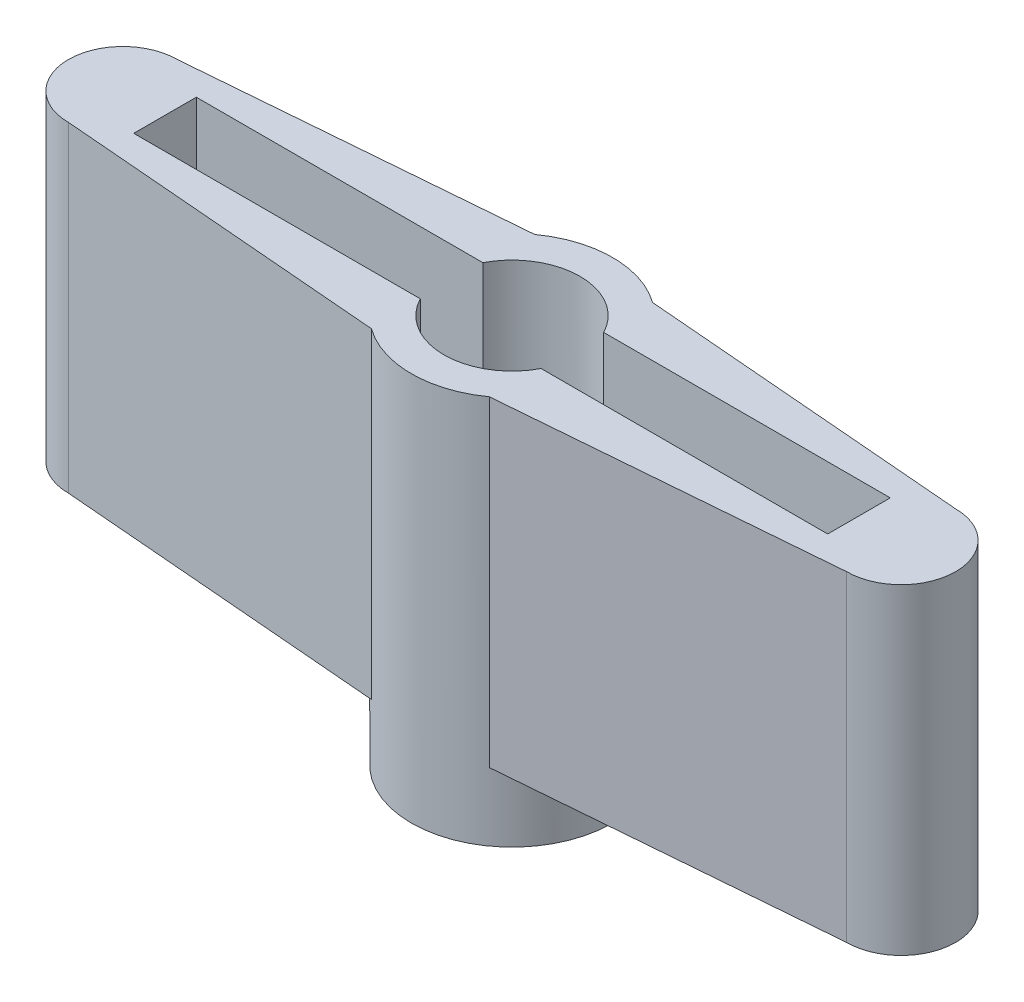
from build123d import *

# Parameters (mm, degrees)
CROQUIS1_R              = 3.7
SALIENTE_EXTRUIR2_DEPTH = 4.3
CROQUIS2_R              = 2.5
CORTAR_EXTRUIR1_DEPTH   = 1.5
CORTAR_EXTRUIR2_START   = -1
CROQUIS3_R              = 2.5
CORTAR_EXTRUIR2_DEPTH   = 1
CROQUIS4_R              = 1
CORTAR_EXTRUIR3_DEPTH   = 1.8
SALIENTE_EXTRUIR3_DEPTH = 1.8
CROQUIS6_R              = 0.595
CORTAR_EXTRUIR4_DEPTH   = 1.8
SKETCH1_R               = 2.5
BOSS_EXTRUDE1_DEPTH     = 10
SKETCH2_W               = 25.5
SKETCH2_H               = 2.3
CUT_EXTRUDE1_DEPTH      = 7


with BuildPart() as part:
    # Croquis1 → Saliente-Extruir2 (new body)
    with BuildSketch(Plane(origin=(0, 0, 0), x_dir=(1, 0, 0), z_dir=(0, 1, 0))):
        with Locations(Location((0, 0, 0), (0, 0, 90))):
            Circle(CROQUIS1_R)
    extrude(amount=SALIENTE_EXTRUIR2_DEPTH)

    # Croquis2 → Cortar-Extruir1 (cut)
    with BuildSketch(Plane.XZ):
        with Locations(Location((0, 0, 0), (0, 0, 270))):
            Circle(CROQUIS2_R)
    extrude(amount=-CORTAR_EXTRUIR1_DEPTH, mode=Mode.SUBTRACT)

    # Croquis3 → Cortar-Extruir2 (cut)
    with BuildSketch(Plane(origin=(0, 4.3, 0), x_dir=(1, 0, 0), z_dir=(0, 1, 0)).offset(CORTAR_EXTRUIR2_START)):
        with Locations(Location((0, 0, 0), (0, 0, 90))):
            Circle(CROQUIS3_R)
    extrude(amount=CORTAR_EXTRUIR2_DEPTH, mode=Mode.SUBTRACT)

    # Croquis4 → Cortar-Extruir3 (cut)
    with BuildSketch(Plane(origin=(0, 3.3, 0), x_dir=(1, 0, 0), z_dir=(0, 1, 0))):
        with Locations(Location((0, 0, 0), (0, 0, 270))):
            Circle(CROQUIS4_R)
    extrude(amount=-CORTAR_EXTRUIR3_DEPTH, mode=Mode.SUBTRACT)

    # Croquis5 → Saliente-Extruir3 (add)
    with BuildSketch(Plane(origin=(0, 4.3, 0), x_dir=(1, 0, 0), z_dir=(0, 1, 0))):
        with BuildLine():
            Line((-2.16564, 3.000000565), (-3.120237459, 0))
            Line((-3.120237459, 0), (-2.16564, -3.000000565))
            Line((-2.16564, -3.000000565), (-14.3, -2))
            ThreePointArc((-14.3, -2), (-16.3, 0), (-14.3, 2))
            Line((-14.3, 2), (-2.16564, 3.000000565))
        make_face()
        with BuildLine():
            Line((3.120237459, 0), (2.16564, -3.000000565))
            Line((2.16564, -3.000000565), (14.3, -2))
            ThreePointArc((14.3, -2), (16.3, 0), (14.3, 2))
            Line((14.3, 2), (2.16564, 3.000000565))
            Line((2.16564, 3.000000565), (3.120237459, 0))
        make_face()
    extrude(amount=-SALIENTE_EXTRUIR3_DEPTH)

    # Croquis6 → Cortar-Extruir4 (cut)
    with BuildSketch(Plane(origin=(0, 4.3, 0), x_dir=(1, 0, 0), z_dir=(0, 1, 0))):
        with Locations(Location((-14.705, 0, 0), (0, 0, 270))):
            Circle(CROQUIS6_R)
        with Locations(Location((-12.705, 0, 0), (0, 0, 270))):
            Circle(CROQUIS6_R)
        with Locations(Location((-10.705, 0, 0), (0, 0, 270))):
            Circle(CROQUIS6_R)
        with Locations(Location((-8.705, 0, 0), (0, 0, 270))):
            Circle(CROQUIS6_R)
        with Locations(Location((-6.705, 0, 0), (0, 0, 270))):
            Circle(CROQUIS6_R)
        with Locations(Location((-4.705, 0, 0), (0, 0, 270))):
            Circle(CROQUIS6_R)
        with Locations(Location((14.705, 0, 0), (0, 0, 90))):
            Circle(CROQUIS6_R)
        with Locations(Location((12.705, 0, 0), (0, 0, 90))):
            Circle(CROQUIS6_R)
        with Locations(Location((10.705, 0, 0), (0, 0, 90))):
            Circle(CROQUIS6_R)
        with Locations(Location((8.705, 0, 0), (0, 0, 90))):
            Circle(CROQUIS6_R)
        with Locations(Location((6.705, 0, 0), (0, 0, 90))):
            Circle(CROQUIS6_R)
        with Locations(Location((4.705, 0, 0), (0, 0, 90))):
            Circle(CROQUIS6_R)
    extrude(amount=-CORTAR_EXTRUIR4_DEPTH, mode=Mode.SUBTRACT)

    # Sketch1 → Boss-Extrude1 (add)
    with BuildSketch(Plane(origin=(0, 4.3, 0), x_dir=(1, 0, 0), z_dir=(0, 1, 0))):
        with BuildLine():
            Line((2.16564, -3.000000565), (14.3, -2))
            ThreePointArc((14.3, -2), (16.3, 0), (14.3, 2))
            Line((14.3, 2), (2.16564, 3.000000565))
            ThreePointArc((2.16564, 3.000000565), (0, 3.7), (-2.16564, 3.000000565))
            Line((-2.16564, 3.000000565), (-14.3, 2))
            ThreePointArc((-14.3, 2), (-16.3, 0), (-14.3, -2))
            Line((-14.3, -2), (-2.16564, -3.000000565))
            ThreePointArc((-2.16564, -3.000000565), (0, -3.7), (2.16564, -3.000000565))
        make_face()
        with Locations(Location((0, 0, 0), (0, 0, 90))):
            Circle(SKETCH1_R, mode=Mode.SUBTRACT)
    extrude(amount=BOSS_EXTRUDE1_DEPTH)

    # Sketch2 → Cut-Extrude1 (cut)
    with BuildSketch(Plane(origin=(0, 14.3, 0), x_dir=(1, 0, 0), z_dir=(0, 1, 0))):
        Rectangle(SKETCH2_W, SKETCH2_H)
    extrude(amount=-CUT_EXTRUDE1_DEPTH, mode=Mode.SUBTRACT)


solid = part.part
